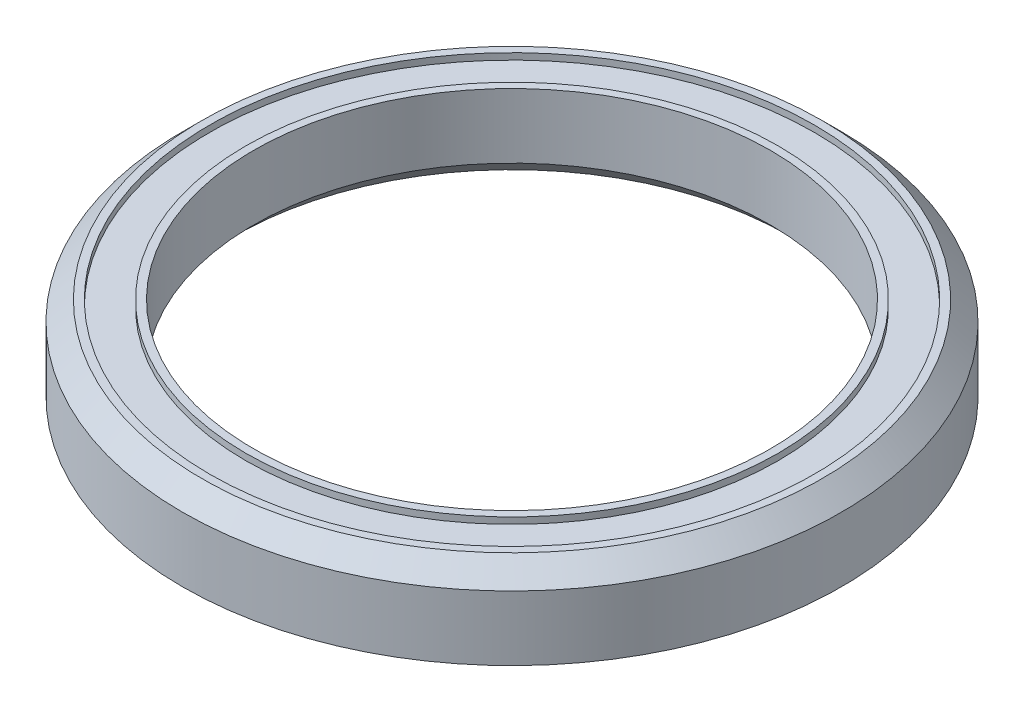
from build123d import *

# Parameters (mm, degrees)
SKETCH_1_R          = 25.5
SKETCH_1_R_2        = 20
EXTRUDE_1_DEPTH     = 6.5
CHAMFER_1_SIZE      = 1.5
CHAMFER_2_SIZE      = 1.5
SKETCH_2_R          = 23.4
SKETCH_2_R_2        = 20.6
CUT_EXTRUDE_1_DEPTH = 0.5
SKETCH_3_R          = 24.9
SKETCH_3_R_2        = 22.1
CUT_EXTRUDE_2_DEPTH = 0.5


with BuildPart() as part:
    # 草图1 → 凸台-拉伸1 (new body)
    with BuildSketch(Plane(origin=(0, 0, 0), x_dir=(1, 0, 0), z_dir=(0, 1, 0))):
        with Locations(Location((0, 0, 0), (0, 0, 90))):
            Circle(SKETCH_1_R)
        with Locations(Location((0, 0, 0), (0, 0, 90))):
            Circle(SKETCH_1_R_2, mode=Mode.SUBTRACT)
    extrude(amount=EXTRUDE_1_DEPTH)

    # 倒角1
    chamfer_1_edges = [part.edges().sort_by_distance(p)[0] for p in [
        (0, 6.5, 25.5),
    ]]
    chamfer(chamfer_1_edges, length=CHAMFER_1_SIZE)

    # 倒角2
    chamfer_2_edges = [part.edges().sort_by_distance(p)[0] for p in [
        (0, 0, 20),
    ]]
    chamfer(chamfer_2_edges, length=CHAMFER_2_SIZE)

    # 草图2 → 切除-拉伸1 (cut)
    with BuildSketch(Plane(origin=(0, 6.5, 0), x_dir=(1, 0, 0), z_dir=(0, 1, 0))):
        with Locations(Location((0, 0, 0), (0, 0, 270))):
            Circle(SKETCH_2_R)
        with Locations(Location((0, 0, 0), (0, 0, 270))):
            Circle(SKETCH_2_R_2, mode=Mode.SUBTRACT)
    extrude(amount=-CUT_EXTRUDE_1_DEPTH, mode=Mode.SUBTRACT)

    # 草图3 → 切除-拉伸2 (cut)
    with BuildSketch(Plane.XZ):
        with Locations(Location((0, 0, 0), (0, 0, 270))):
            Circle(SKETCH_3_R)
        with Locations(Location((0, 0, 0), (0, 0, 270))):
            Circle(SKETCH_3_R_2, mode=Mode.SUBTRACT)
    extrude(amount=-CUT_EXTRUDE_2_DEPTH, mode=Mode.SUBTRACT)


solid = part.part
